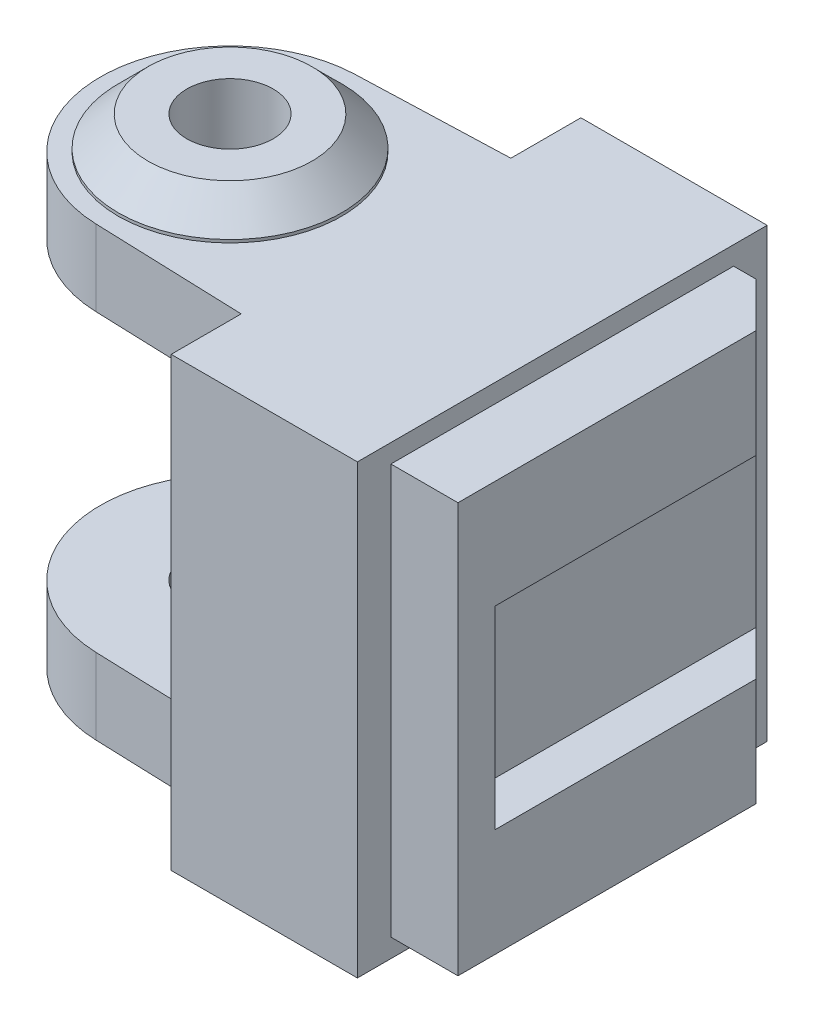
from build123d import *

# Parameters (mm, degrees)
SKETCH_1_R                 = 2.9
EXTRUDE_1_DEPTH            = 30
SKETCH_2_W                 = 27.5
SKETCH_2_H                 = 30
EXTRUDE_2_DEPTH            = 17
CUT_EXTRUDE_1_REACH        = 39.833
SKETCH_3_W                 = 27.5
SKETCH_3_H                 = 19.8
SKETCH_4_W                 = 27.5
SKETCH_4_H                 = 30
SKETCH_4_W_2               = 23
SKETCH_4_H_2               = 27.5
CUT_EXTRUDE_2_DEPTH        = 4.5
CHAMFER_1_SIZE             = 3
SKETCH_5_W                 = 20.5
SKETCH_5_H                 = 13
CUT_EXTRUDE_3_DEPTH        = 3
SKETCH_6_R                 = 7.5
SKETCH_6_R_2               = 2.9
EXTRUDE_3_DEPTH            = 2.2
CHAMFER_2_SIZE             = 2
CHAMFER_2_OF_MIRROR_1_SIZE = 2


with BuildPart() as part:
    # 草图1 → 凸台-拉伸1 (new body)
    with BuildSketch(Plane(origin=(0, 0, 0), x_dir=(1, 0, 0), z_dir=(0, 1, 0))):
        with BuildLine():
            Line((-0.305751289, 8.694625705), (9.8, 9.05))
            Line((9.8, 9.05), (9.8, -9.05))
            Line((9.8, -9.05), (-0.305751289, -8.694625705))
            ThreePointArc((-0.305751289, -8.694625705), (-8.7, 0), (-0.305751289, 8.694625705))
        make_face()
        with Locations(Location((0, 0, 0), (0, 0, 270))):
            Circle(SKETCH_1_R, mode=Mode.SUBTRACT)
    extrude(amount=EXTRUDE_1_DEPTH)

    # 草图2 → 凸台-拉伸2 (add)
    with BuildSketch(Plane(origin=(9.8, 0, 0), x_dir=(0, 0, -1), z_dir=(1, 0, 0))):
        with Locations((0, 15)):
            Rectangle(SKETCH_2_W, SKETCH_2_H)
    extrude(amount=EXTRUDE_2_DEPTH)

    # 草图3 → 切除-拉伸1 (cut, up to next)
    with BuildSketch(Plane.ZY.offset(-9.8), mode=Mode.PRIVATE) as cut_extrude_1_sk1:
        with Locations((0, 15)):
            Rectangle(SKETCH_3_W, SKETCH_3_H)
    cut_extrude_1_tool1 = extrude(cut_extrude_1_sk1.sketch, amount=CUT_EXTRUDE_1_REACH, mode=Mode.PRIVATE) & part.part
    add(cut_extrude_1_tool1.solids().sort_by_distance((9.8, 15, 0))[0], mode=Mode.SUBTRACT)

    # 草图4 → 切除-拉伸2 (cut)
    with BuildSketch(Plane(origin=(26.8, 0, 0), x_dir=(0, 0, -1), z_dir=(1, 0, 0))):
        with Locations((0, 15)):
            Rectangle(SKETCH_4_W, SKETCH_4_H)
        with Locations((0, 15)):
            Rectangle(SKETCH_4_W_2, SKETCH_4_H_2, mode=Mode.SUBTRACT)
    extrude(amount=-CUT_EXTRUDE_2_DEPTH, mode=Mode.SUBTRACT)

    # 倒角1
    chamfer_1_edges = [part.edges().sort_by_distance(p)[0] for p in [
        (26.8, 15, -11.5),
    ]]
    chamfer(chamfer_1_edges, length=CHAMFER_1_SIZE)

    # 草图5 → 切除-拉伸3 (cut)
    with BuildSketch(Plane(origin=(26.8, 0, 0), x_dir=(0, 0, -1), z_dir=(1, 0, 0))):
        with Locations((1.25, 15)):
            Rectangle(SKETCH_5_W, SKETCH_5_H)
    extrude(amount=-CUT_EXTRUDE_3_DEPTH, mode=Mode.SUBTRACT)

    # 草图6 → 凸台-拉伸3 (add)
    with BuildSketch(Plane(origin=(0, 30, 0), x_dir=(1, 0, 0), z_dir=(0, 1, 0))):
        with Locations(Location((0, 0, 0), (0, 0, 270))):
            Circle(SKETCH_6_R)
        with Locations(Location((0, 0, 0), (0, 0, 270))):
            Circle(SKETCH_6_R_2, mode=Mode.SUBTRACT)
    extrude_3 = extrude(amount=EXTRUDE_3_DEPTH)

    # 倒角2
    chamfer_2_edges = [part.edges().sort_by_distance(p)[0] for p in [
        (0, 32.2, -7.5),
    ]]
    chamfer(chamfer_2_edges, length=CHAMFER_2_SIZE)

    # 镜向1: 凸台-拉伸3 across plane
    add(extrude_3.mirror(Plane(origin=(0, 15, 0), x_dir=(0, 0, 1), z_dir=(0, -1, 0))))

    # 倒角2 of 镜向1
    chamfer_2_of_mirror_1_edges = [part.edges().sort_by_distance(p)[0] for p in [
        (0, -2.2, -7.5),
    ]]
    chamfer(chamfer_2_of_mirror_1_edges, length=CHAMFER_2_OF_MIRROR_1_SIZE)


solid = part.part
